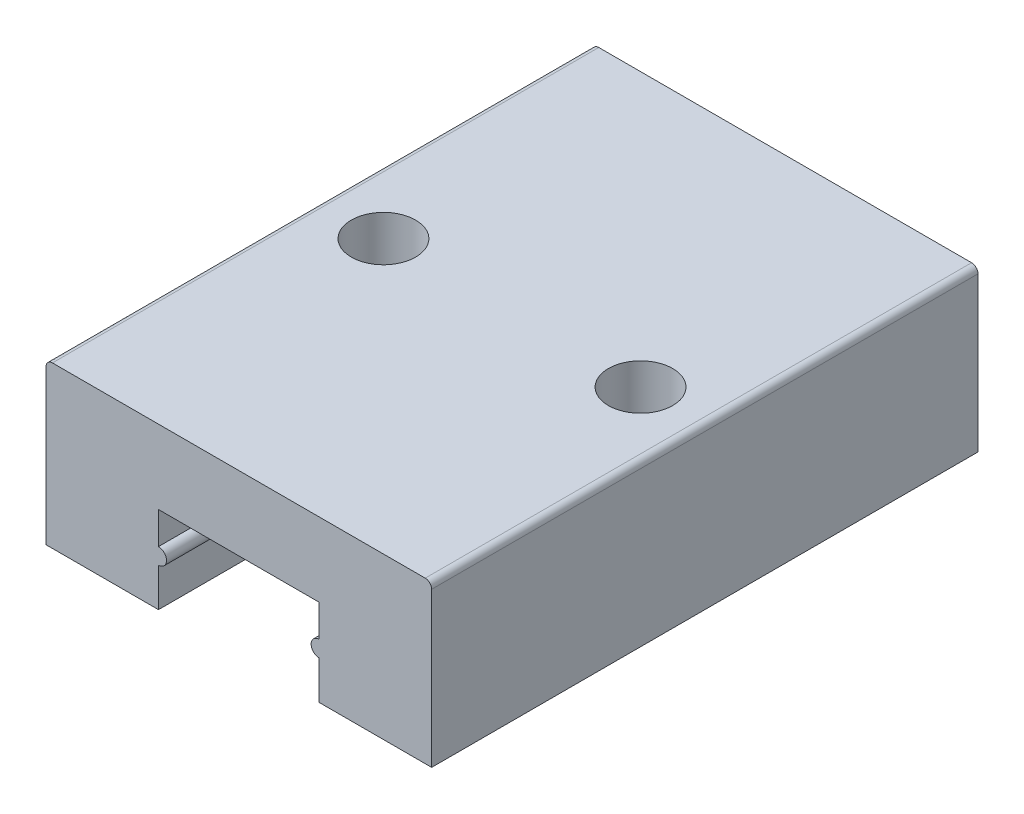
from build123d import *

# Parameters (mm, degrees)
BOSS_EXTRUDE1_DEPTH = 8.5
SKETCH2_R           = 1
CUT_EXTRUDE1_DEPTH  = 2
FILLET1_R           = 0.2


with BuildPart() as part:
    # Sketch1 → Boss-Extrude1 (new, symmetric)
    with BuildSketch(Plane.XY):
        with BuildLine():
            Line((2.5, 0), (6, 0))
            Line((6, 0), (6, 5))
            Line((6, 5), (-6, 5))
            Line((-6, 5), (-6, 0))
            Line((-6, 0), (-2.5, 0))
            Line((-2.5, 0), (-2.5, 1.2))
            ThreePointArc((-2.5, 1.2), (-2.25, 1.45), (-2.5, 1.7))
            Line((-2.5, 1.7), (-2.5, 2.7))
            Line((-2.5, 2.7), (2.5, 2.7))
            Line((2.5, 2.7), (2.5, 1.7))
            ThreePointArc((2.5, 1.7), (2.25, 1.45), (2.5, 1.2))
            Line((2.5, 1.2), (2.5, 0))
        make_face()
    extrude(amount=BOSS_EXTRUDE1_DEPTH, both=True)

    # Sketch2 → Cut-Extrude1 (cut)
    with BuildSketch(Plane(origin=(0, 5, 0), x_dir=(1, 0, 0), z_dir=(0, 1, 0))):
        with Locations(Location((4, 0, 0), (0, 0, 270))):
            Circle(SKETCH2_R)
        with Locations(Location((-4, 0, 0), (0, 0, 90))):
            Circle(SKETCH2_R)
    extrude(amount=-CUT_EXTRUDE1_DEPTH, mode=Mode.SUBTRACT)

    # Fillet1
    fillet1_edges = [part.edges().sort_by_distance(p)[0] for p in [
        (-6, 5, 0),
        (6, 5, 0),
    ]]
    fillet(fillet1_edges, radius=FILLET1_R)


solid = part.part
